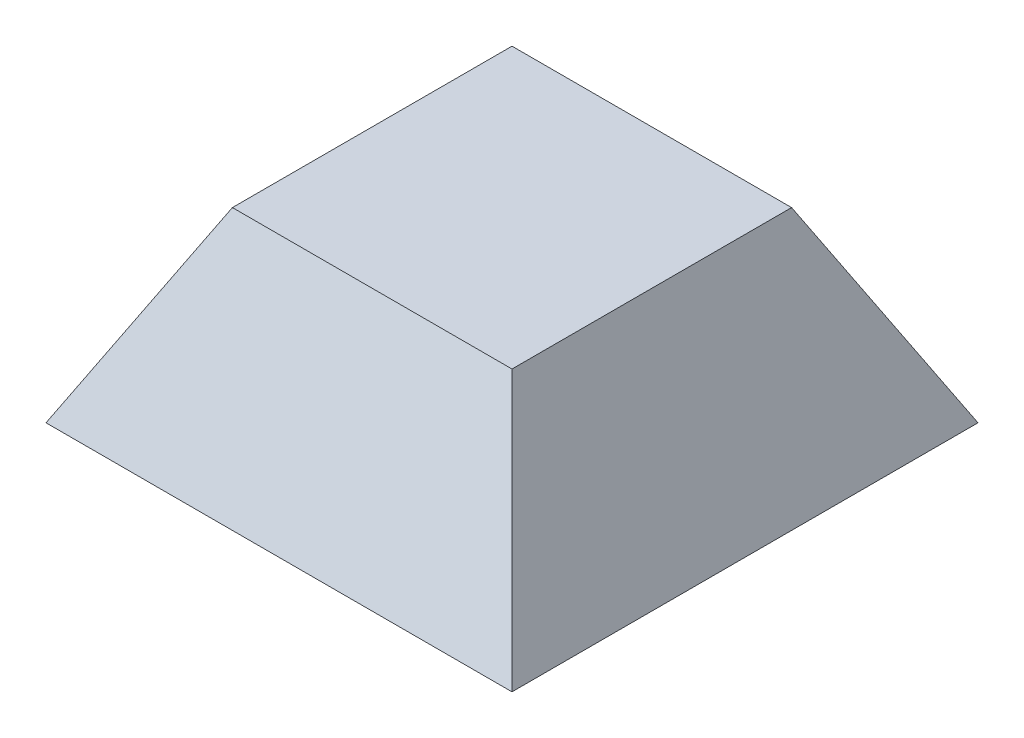
from build123d import *


with BuildPart() as part:
    # 草图1 → 放样1 section 0
    with BuildSketch(Plane(origin=(0, 0, 0), x_dir=(1, 0, 0), z_dir=(0, 1, 0))):
        with BuildLine():
            Line((-50, -50), (50, -50))
            Line((50, -50), (50, 50))
            Line((50, 50), (-50, 50))
            Line((-50, 50), (-50, -50))
        make_face()
    # 草图2 → 放样1 section 1
    with BuildSketch(Plane(origin=(0, 40, 0), x_dir=(1, 0, 0), z_dir=(0, 1, 0))):
        with BuildLine():
            Line((-30, 30), (30, 30))
            Line((30, 30), (30, -30))
            Line((30, -30), (-30, -30))
            Line((-30, -30), (-30, 30))
        make_face()
    loft()


solid = part.part
